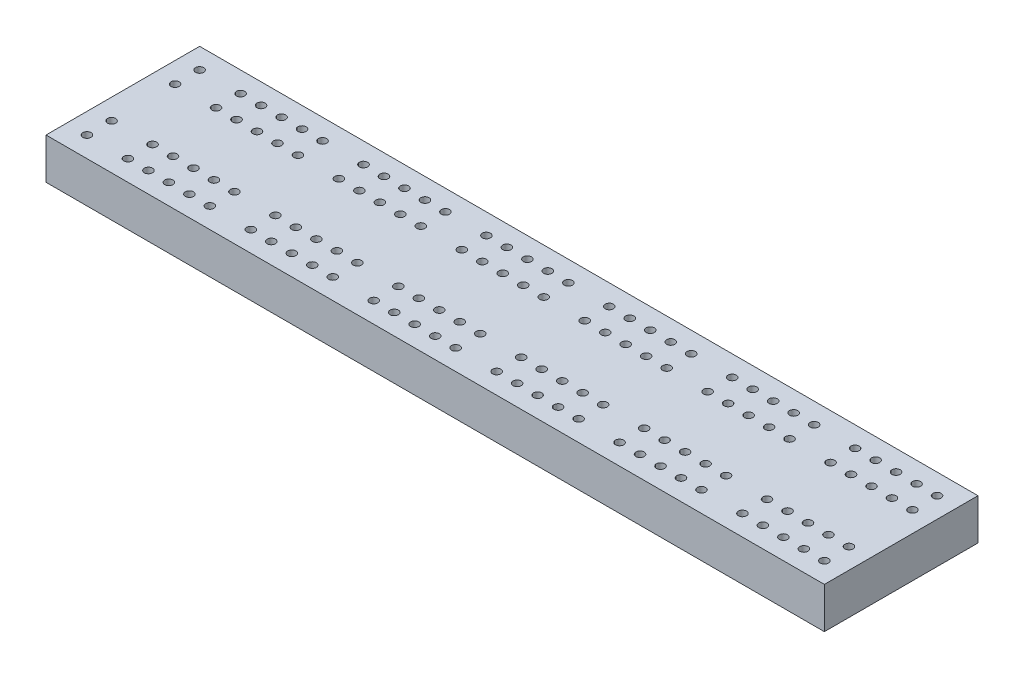
from build123d import *

# Parameters (mm, degrees)
SKETCH1_W                = 380
SKETCH1_H                = 75
BOSS_EXTRUDE1_DEPTH      = 20
F_4_0_4_DIAMETER_HOLE1_D = 4
LPATTERN1_COUNT          = 37
LPATTERN1_PITCH          = 10
LPATTERN1_COUNT_DIR2     = 2
LPATTERN1_PITCH_DIR2     = 12
MIRROR1_COPY_1_D         = 4
MIRROR1_COPY_2_D         = 4
MIRROR1_COPY_3_D         = 4
MIRROR1_COPY_4_D         = 4
MIRROR1_COPY_5_D         = 4
MIRROR1_COPY_6_D         = 4
MIRROR1_COPY_7_D         = 4
MIRROR1_COPY_8_D         = 4
MIRROR1_COPY_9_D         = 4
MIRROR1_COPY_10_D        = 4
MIRROR1_COPY_11_D        = 4
MIRROR1_COPY_12_D        = 4
MIRROR1_COPY_13_D        = 4
MIRROR1_COPY_14_D        = 4
MIRROR1_COPY_15_D        = 4
MIRROR1_COPY_16_D        = 4
MIRROR1_COPY_17_D        = 4
MIRROR1_COPY_18_D        = 4
MIRROR1_COPY_19_D        = 4
MIRROR1_COPY_20_D        = 4
MIRROR1_COPY_21_D        = 4
MIRROR1_COPY_22_D        = 4
MIRROR1_COPY_23_D        = 4
MIRROR1_COPY_24_D        = 4
MIRROR1_COPY_25_D        = 4
MIRROR1_COPY_26_D        = 4
MIRROR1_COPY_27_D        = 4
MIRROR1_COPY_28_D        = 4
MIRROR1_COPY_29_D        = 4
MIRROR1_COPY_30_D        = 4
MIRROR1_COPY_31_D        = 4
MIRROR1_COPY_32_D        = 4
MIRROR1_COPY_33_D        = 4
MIRROR1_COPY_34_D        = 4
MIRROR1_COPY_35_D        = 4
MIRROR1_COPY_36_D        = 4
MIRROR1_COPY_37_D        = 4
MIRROR1_COPY_38_D        = 4
MIRROR1_COPY_39_D        = 4
MIRROR1_COPY_40_D        = 4
MIRROR1_COPY_41_D        = 4
MIRROR1_COPY_42_D        = 4
MIRROR1_COPY_43_D        = 4
MIRROR1_COPY_44_D        = 4
MIRROR1_COPY_45_D        = 4
MIRROR1_COPY_46_D        = 4
MIRROR1_COPY_47_D        = 4
MIRROR1_COPY_48_D        = 4
MIRROR1_COPY_49_D        = 4
MIRROR1_COPY_50_D        = 4
MIRROR1_COPY_51_D        = 4
MIRROR1_COPY_52_D        = 4
MIRROR1_COPY_53_D        = 4
MIRROR1_COPY_54_D        = 4
MIRROR1_COPY_55_D        = 4
MIRROR1_COPY_56_D        = 4
MIRROR1_COPY_57_D        = 4
MIRROR1_COPY_58_D        = 4
MIRROR1_COPY_59_D        = 4
MIRROR1_COPY_60_D        = 4
MIRROR1_COPY_61_D        = 4


with BuildPart() as part:
    # Sketch1 → Boss-Extrude1 (new body)
    with BuildSketch(Plane(origin=(0, 0, 0), x_dir=(1, 0, 0), z_dir=(0, 1, 0))):
        with Locations((190, 0)):
            Rectangle(SKETCH1_W, SKETCH1_H)
    extrude(amount=BOSS_EXTRUDE1_DEPTH)

    # Ø4.0 (4) Diameter Hole1 (through all)
    with Locations(Plane(origin=(0, 20, 0), x_dir=(1, 0, 0), z_dir=(0, 1, 0))):
        with Locations((10, 27.5)):
            f_4_0_4_diameter_hole1 = Hole(F_4_0_4_DIAMETER_HOLE1_D / 2)

    # LPattern1: 4.0 _4_ Diameter Hole1 37 × 2, 12 skipped
    with Locations(*[(i * LPATTERN1_PITCH, 0, j * LPATTERN1_PITCH_DIR2) for i in range(LPATTERN1_COUNT) for j in range(LPATTERN1_COUNT_DIR2) if (i, j) not in ((0, 0), (1, 0), (1, 1), (7, 0), (7, 1), (13, 0), (13, 1), (19, 0), (19, 1), (25, 0), (25, 1), (31, 0), (31, 1))]):
        add(f_4_0_4_diameter_hole1, mode=Mode.SUBTRACT)

    # Mirror1: Ø4.0 (4) Diameter Hole1 across plane
    add(f_4_0_4_diameter_hole1.mirror(Plane.XY), mode=Mode.SUBTRACT)

    # Mirror1 copy 1 (through all)
    with Locations(Plane(origin=(0, 20, -12), x_dir=(1, 0, 0), z_dir=(0, 1, 0))):
        with Locations((10, -27.5)):
            Hole(MIRROR1_COPY_1_D / 2)

    # Mirror1 copy 2 (through all)
    with Locations(Plane(origin=(20, 20, 0), x_dir=(1, 0, 0), z_dir=(0, 1, 0))):
        with Locations((10, -27.5)):
            Hole(MIRROR1_COPY_2_D / 2)

    # Mirror1 copy 3 (through all)
    with Locations(Plane(origin=(20, 20, -12), x_dir=(1, 0, 0), z_dir=(0, 1, 0))):
        with Locations((10, -27.5)):
            Hole(MIRROR1_COPY_3_D / 2)

    # Mirror1 copy 4 (through all)
    with Locations(Plane(origin=(30, 20, 0), x_dir=(1, 0, 0), z_dir=(0, 1, 0))):
        with Locations((10, -27.5)):
            Hole(MIRROR1_COPY_4_D / 2)

    # Mirror1 copy 5 (through all)
    with Locations(Plane(origin=(30, 20, -12), x_dir=(1, 0, 0), z_dir=(0, 1, 0))):
        with Locations((10, -27.5)):
            Hole(MIRROR1_COPY_5_D / 2)

    # Mirror1 copy 6 (through all)
    with Locations(Plane(origin=(40, 20, 0), x_dir=(1, 0, 0), z_dir=(0, 1, 0))):
        with Locations((10, -27.5)):
            Hole(MIRROR1_COPY_6_D / 2)

    # Mirror1 copy 7 (through all)
    with Locations(Plane(origin=(40, 20, -12), x_dir=(1, 0, 0), z_dir=(0, 1, 0))):
        with Locations((10, -27.5)):
            Hole(MIRROR1_COPY_7_D / 2)

    # Mirror1 copy 8 (through all)
    with Locations(Plane(origin=(50, 20, 0), x_dir=(1, 0, 0), z_dir=(0, 1, 0))):
        with Locations((10, -27.5)):
            Hole(MIRROR1_COPY_8_D / 2)

    # Mirror1 copy 9 (through all)
    with Locations(Plane(origin=(50, 20, -12), x_dir=(1, 0, 0), z_dir=(0, 1, 0))):
        with Locations((10, -27.5)):
            Hole(MIRROR1_COPY_9_D / 2)

    # Mirror1 copy 10 (through all)
    with Locations(Plane(origin=(60, 20, 0), x_dir=(1, 0, 0), z_dir=(0, 1, 0))):
        with Locations((10, -27.5)):
            Hole(MIRROR1_COPY_10_D / 2)

    # Mirror1 copy 11 (through all)
    with Locations(Plane(origin=(60, 20, -12), x_dir=(1, 0, 0), z_dir=(0, 1, 0))):
        with Locations((10, -27.5)):
            Hole(MIRROR1_COPY_11_D / 2)

    # Mirror1 copy 12 (through all)
    with Locations(Plane(origin=(80, 20, 0), x_dir=(1, 0, 0), z_dir=(0, 1, 0))):
        with Locations((10, -27.5)):
            Hole(MIRROR1_COPY_12_D / 2)

    # Mirror1 copy 13 (through all)
    with Locations(Plane(origin=(80, 20, -12), x_dir=(1, 0, 0), z_dir=(0, 1, 0))):
        with Locations((10, -27.5)):
            Hole(MIRROR1_COPY_13_D / 2)

    # Mirror1 copy 14 (through all)
    with Locations(Plane(origin=(90, 20, 0), x_dir=(1, 0, 0), z_dir=(0, 1, 0))):
        with Locations((10, -27.5)):
            Hole(MIRROR1_COPY_14_D / 2)

    # Mirror1 copy 15 (through all)
    with Locations(Plane(origin=(90, 20, -12), x_dir=(1, 0, 0), z_dir=(0, 1, 0))):
        with Locations((10, -27.5)):
            Hole(MIRROR1_COPY_15_D / 2)

    # Mirror1 copy 16 (through all)
    with Locations(Plane(origin=(100, 20, 0), x_dir=(1, 0, 0), z_dir=(0, 1, 0))):
        with Locations((10, -27.5)):
            Hole(MIRROR1_COPY_16_D / 2)

    # Mirror1 copy 17 (through all)
    with Locations(Plane(origin=(100, 20, -12), x_dir=(1, 0, 0), z_dir=(0, 1, 0))):
        with Locations((10, -27.5)):
            Hole(MIRROR1_COPY_17_D / 2)

    # Mirror1 copy 18 (through all)
    with Locations(Plane(origin=(110, 20, 0), x_dir=(1, 0, 0), z_dir=(0, 1, 0))):
        with Locations((10, -27.5)):
            Hole(MIRROR1_COPY_18_D / 2)

    # Mirror1 copy 19 (through all)
    with Locations(Plane(origin=(110, 20, -12), x_dir=(1, 0, 0), z_dir=(0, 1, 0))):
        with Locations((10, -27.5)):
            Hole(MIRROR1_COPY_19_D / 2)

    # Mirror1 copy 20 (through all)
    with Locations(Plane(origin=(120, 20, 0), x_dir=(1, 0, 0), z_dir=(0, 1, 0))):
        with Locations((10, -27.5)):
            Hole(MIRROR1_COPY_20_D / 2)

    # Mirror1 copy 21 (through all)
    with Locations(Plane(origin=(120, 20, -12), x_dir=(1, 0, 0), z_dir=(0, 1, 0))):
        with Locations((10, -27.5)):
            Hole(MIRROR1_COPY_21_D / 2)

    # Mirror1 copy 22 (through all)
    with Locations(Plane(origin=(140, 20, 0), x_dir=(1, 0, 0), z_dir=(0, 1, 0))):
        with Locations((10, -27.5)):
            Hole(MIRROR1_COPY_22_D / 2)

    # Mirror1 copy 23 (through all)
    with Locations(Plane(origin=(140, 20, -12), x_dir=(1, 0, 0), z_dir=(0, 1, 0))):
        with Locations((10, -27.5)):
            Hole(MIRROR1_COPY_23_D / 2)

    # Mirror1 copy 24 (through all)
    with Locations(Plane(origin=(150, 20, 0), x_dir=(1, 0, 0), z_dir=(0, 1, 0))):
        with Locations((10, -27.5)):
            Hole(MIRROR1_COPY_24_D / 2)

    # Mirror1 copy 25 (through all)
    with Locations(Plane(origin=(150, 20, -12), x_dir=(1, 0, 0), z_dir=(0, 1, 0))):
        with Locations((10, -27.5)):
            Hole(MIRROR1_COPY_25_D / 2)

    # Mirror1 copy 26 (through all)
    with Locations(Plane(origin=(160, 20, 0), x_dir=(1, 0, 0), z_dir=(0, 1, 0))):
        with Locations((10, -27.5)):
            Hole(MIRROR1_COPY_26_D / 2)

    # Mirror1 copy 27 (through all)
    with Locations(Plane(origin=(160, 20, -12), x_dir=(1, 0, 0), z_dir=(0, 1, 0))):
        with Locations((10, -27.5)):
            Hole(MIRROR1_COPY_27_D / 2)

    # Mirror1 copy 28 (through all)
    with Locations(Plane(origin=(170, 20, 0), x_dir=(1, 0, 0), z_dir=(0, 1, 0))):
        with Locations((10, -27.5)):
            Hole(MIRROR1_COPY_28_D / 2)

    # Mirror1 copy 29 (through all)
    with Locations(Plane(origin=(170, 20, -12), x_dir=(1, 0, 0), z_dir=(0, 1, 0))):
        with Locations((10, -27.5)):
            Hole(MIRROR1_COPY_29_D / 2)

    # Mirror1 copy 30 (through all)
    with Locations(Plane(origin=(180, 20, 0), x_dir=(1, 0, 0), z_dir=(0, 1, 0))):
        with Locations((10, -27.5)):
            Hole(MIRROR1_COPY_30_D / 2)

    # Mirror1 copy 31 (through all)
    with Locations(Plane(origin=(180, 20, -12), x_dir=(1, 0, 0), z_dir=(0, 1, 0))):
        with Locations((10, -27.5)):
            Hole(MIRROR1_COPY_31_D / 2)

    # Mirror1 copy 32 (through all)
    with Locations(Plane(origin=(200, 20, 0), x_dir=(1, 0, 0), z_dir=(0, 1, 0))):
        with Locations((10, -27.5)):
            Hole(MIRROR1_COPY_32_D / 2)

    # Mirror1 copy 33 (through all)
    with Locations(Plane(origin=(200, 20, -12), x_dir=(1, 0, 0), z_dir=(0, 1, 0))):
        with Locations((10, -27.5)):
            Hole(MIRROR1_COPY_33_D / 2)

    # Mirror1 copy 34 (through all)
    with Locations(Plane(origin=(210, 20, 0), x_dir=(1, 0, 0), z_dir=(0, 1, 0))):
        with Locations((10, -27.5)):
            Hole(MIRROR1_COPY_34_D / 2)

    # Mirror1 copy 35 (through all)
    with Locations(Plane(origin=(210, 20, -12), x_dir=(1, 0, 0), z_dir=(0, 1, 0))):
        with Locations((10, -27.5)):
            Hole(MIRROR1_COPY_35_D / 2)

    # Mirror1 copy 36 (through all)
    with Locations(Plane(origin=(220, 20, 0), x_dir=(1, 0, 0), z_dir=(0, 1, 0))):
        with Locations((10, -27.5)):
            Hole(MIRROR1_COPY_36_D / 2)

    # Mirror1 copy 37 (through all)
    with Locations(Plane(origin=(220, 20, -12), x_dir=(1, 0, 0), z_dir=(0, 1, 0))):
        with Locations((10, -27.5)):
            Hole(MIRROR1_COPY_37_D / 2)

    # Mirror1 copy 38 (through all)
    with Locations(Plane(origin=(230, 20, 0), x_dir=(1, 0, 0), z_dir=(0, 1, 0))):
        with Locations((10, -27.5)):
            Hole(MIRROR1_COPY_38_D / 2)

    # Mirror1 copy 39 (through all)
    with Locations(Plane(origin=(230, 20, -12), x_dir=(1, 0, 0), z_dir=(0, 1, 0))):
        with Locations((10, -27.5)):
            Hole(MIRROR1_COPY_39_D / 2)

    # Mirror1 copy 40 (through all)
    with Locations(Plane(origin=(240, 20, 0), x_dir=(1, 0, 0), z_dir=(0, 1, 0))):
        with Locations((10, -27.5)):
            Hole(MIRROR1_COPY_40_D / 2)

    # Mirror1 copy 41 (through all)
    with Locations(Plane(origin=(240, 20, -12), x_dir=(1, 0, 0), z_dir=(0, 1, 0))):
        with Locations((10, -27.5)):
            Hole(MIRROR1_COPY_41_D / 2)

    # Mirror1 copy 42 (through all)
    with Locations(Plane(origin=(260, 20, 0), x_dir=(1, 0, 0), z_dir=(0, 1, 0))):
        with Locations((10, -27.5)):
            Hole(MIRROR1_COPY_42_D / 2)

    # Mirror1 copy 43 (through all)
    with Locations(Plane(origin=(260, 20, -12), x_dir=(1, 0, 0), z_dir=(0, 1, 0))):
        with Locations((10, -27.5)):
            Hole(MIRROR1_COPY_43_D / 2)

    # Mirror1 copy 44 (through all)
    with Locations(Plane(origin=(270, 20, 0), x_dir=(1, 0, 0), z_dir=(0, 1, 0))):
        with Locations((10, -27.5)):
            Hole(MIRROR1_COPY_44_D / 2)

    # Mirror1 copy 45 (through all)
    with Locations(Plane(origin=(270, 20, -12), x_dir=(1, 0, 0), z_dir=(0, 1, 0))):
        with Locations((10, -27.5)):
            Hole(MIRROR1_COPY_45_D / 2)

    # Mirror1 copy 46 (through all)
    with Locations(Plane(origin=(280, 20, 0), x_dir=(1, 0, 0), z_dir=(0, 1, 0))):
        with Locations((10, -27.5)):
            Hole(MIRROR1_COPY_46_D / 2)

    # Mirror1 copy 47 (through all)
    with Locations(Plane(origin=(280, 20, -12), x_dir=(1, 0, 0), z_dir=(0, 1, 0))):
        with Locations((10, -27.5)):
            Hole(MIRROR1_COPY_47_D / 2)

    # Mirror1 copy 48 (through all)
    with Locations(Plane(origin=(290, 20, 0), x_dir=(1, 0, 0), z_dir=(0, 1, 0))):
        with Locations((10, -27.5)):
            Hole(MIRROR1_COPY_48_D / 2)

    # Mirror1 copy 49 (through all)
    with Locations(Plane(origin=(290, 20, -12), x_dir=(1, 0, 0), z_dir=(0, 1, 0))):
        with Locations((10, -27.5)):
            Hole(MIRROR1_COPY_49_D / 2)

    # Mirror1 copy 50 (through all)
    with Locations(Plane(origin=(300, 20, 0), x_dir=(1, 0, 0), z_dir=(0, 1, 0))):
        with Locations((10, -27.5)):
            Hole(MIRROR1_COPY_50_D / 2)

    # Mirror1 copy 51 (through all)
    with Locations(Plane(origin=(300, 20, -12), x_dir=(1, 0, 0), z_dir=(0, 1, 0))):
        with Locations((10, -27.5)):
            Hole(MIRROR1_COPY_51_D / 2)

    # Mirror1 copy 52 (through all)
    with Locations(Plane(origin=(320, 20, 0), x_dir=(1, 0, 0), z_dir=(0, 1, 0))):
        with Locations((10, -27.5)):
            Hole(MIRROR1_COPY_52_D / 2)

    # Mirror1 copy 53 (through all)
    with Locations(Plane(origin=(320, 20, -12), x_dir=(1, 0, 0), z_dir=(0, 1, 0))):
        with Locations((10, -27.5)):
            Hole(MIRROR1_COPY_53_D / 2)

    # Mirror1 copy 54 (through all)
    with Locations(Plane(origin=(330, 20, 0), x_dir=(1, 0, 0), z_dir=(0, 1, 0))):
        with Locations((10, -27.5)):
            Hole(MIRROR1_COPY_54_D / 2)

    # Mirror1 copy 55 (through all)
    with Locations(Plane(origin=(330, 20, -12), x_dir=(1, 0, 0), z_dir=(0, 1, 0))):
        with Locations((10, -27.5)):
            Hole(MIRROR1_COPY_55_D / 2)

    # Mirror1 copy 56 (through all)
    with Locations(Plane(origin=(340, 20, 0), x_dir=(1, 0, 0), z_dir=(0, 1, 0))):
        with Locations((10, -27.5)):
            Hole(MIRROR1_COPY_56_D / 2)

    # Mirror1 copy 57 (through all)
    with Locations(Plane(origin=(340, 20, -12), x_dir=(1, 0, 0), z_dir=(0, 1, 0))):
        with Locations((10, -27.5)):
            Hole(MIRROR1_COPY_57_D / 2)

    # Mirror1 copy 58 (through all)
    with Locations(Plane(origin=(350, 20, 0), x_dir=(1, 0, 0), z_dir=(0, 1, 0))):
        with Locations((10, -27.5)):
            Hole(MIRROR1_COPY_58_D / 2)

    # Mirror1 copy 59 (through all)
    with Locations(Plane(origin=(350, 20, -12), x_dir=(1, 0, 0), z_dir=(0, 1, 0))):
        with Locations((10, -27.5)):
            Hole(MIRROR1_COPY_59_D / 2)

    # Mirror1 copy 60 (through all)
    with Locations(Plane(origin=(360, 20, 0), x_dir=(1, 0, 0), z_dir=(0, 1, 0))):
        with Locations((10, -27.5)):
            Hole(MIRROR1_COPY_60_D / 2)

    # Mirror1 copy 61 (through all)
    with Locations(Plane(origin=(360, 20, -12), x_dir=(1, 0, 0), z_dir=(0, 1, 0))):
        with Locations((10, -27.5)):
            Hole(MIRROR1_COPY_61_D / 2)


solid = part.part
